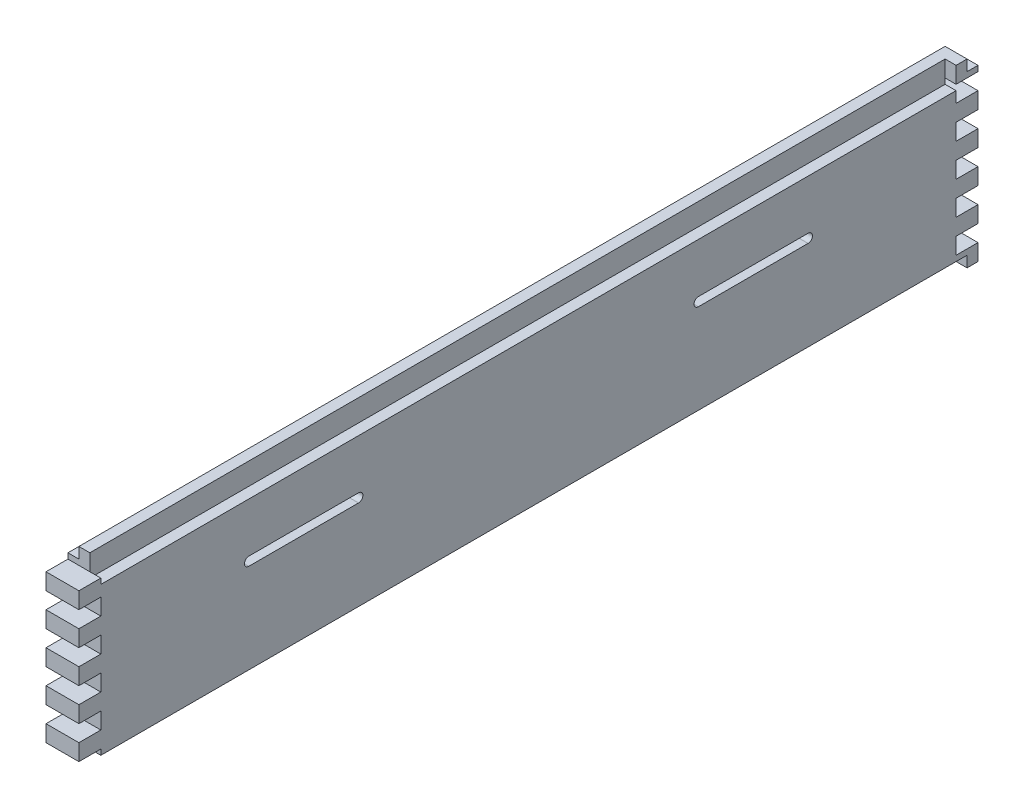
from build123d import *

# Parameters (mm, degrees)
EXTRUDE_1_DEPTH        = 820
SKETCH_2_W             = 10
SKETCH_2_H             = 10
EXTRUDE_2_DEPTH        = 20
SKETCH_4_W             = 20
SKETCH_4_H             = 20
EXTRUDE_3_DEPTH        = 10
SKETCH_5_W             = 10
SKETCH_5_H             = 10
CUT_EXTRUDE_2_DEPTH    = 837.973715238
CUT_EXTRUDE_3_DEPTH    = 837.973715238
SKETCH_7_W             = 20
SKETCH_7_H             = 15
CUT_EXTRUDE_4_DEPTH    = 837.973715238
PATTERN_LINEAR_1_COUNT = 6
PATTERN_LINEAR_1_PITCH = 30
SKETCH_8_W             = 20
SKETCH_8_H             = 15
CUT_EXTRUDE_5_DEPTH    = 837.973715238
PATTERN_LINEAR_2_COUNT = 5
PATTERN_LINEAR_2_PITCH = 30


with BuildPart() as part:
    # Эскиз1 → Бобышка-Вытянуть1 (new body)
    with BuildSketch(Plane.XY):
        Polygon((0, 0), (0, 155), (10, 155), (10, 165), (20, 165), (20, 145), (30, 145), (30, 10), (10, 10), (10, 0), align=None)
    extrude(amount=EXTRUDE_1_DEPTH)

    # Эскиз2 → Бобышка-Вытянуть2 (add)
    with BuildSketch(Plane(origin=(10, 0, 0), x_dir=(0, 0, -1), z_dir=(1, 0, 0))):
        with Locations((-815, 5)):
            Rectangle(SKETCH_2_W, SKETCH_2_H)
        with Locations((-5, 5)):
            Rectangle(SKETCH_2_W, SKETCH_2_H)
    extrude(amount=EXTRUDE_2_DEPTH)

    # Эскиз4 → Бобышка-Вытянуть3 (add)
    with BuildSketch(Plane(origin=(20, 0, 0), x_dir=(0, 0, -1), z_dir=(1, 0, 0))):
        with Locations((-810, 155)):
            Rectangle(SKETCH_4_W, SKETCH_4_H)
        with Locations((-10, 155)):
            Rectangle(SKETCH_4_W, SKETCH_4_H)
    extrude(amount=EXTRUDE_3_DEPTH)

    # Эскиз5 → Вырез-Вытянуть2 (cut, through all)
    with BuildSketch(Plane(origin=(30, 0, 0), x_dir=(0, 0, -1), z_dir=(1, 0, 0))):
        with Locations((-815, 160)):
            Rectangle(SKETCH_5_W, SKETCH_5_H)
        with Locations((-5, 160)):
            Rectangle(SKETCH_5_W, SKETCH_5_H)
    extrude(amount=-CUT_EXTRUDE_2_DEPTH, mode=Mode.SUBTRACT)

    # Эскиз6 → Вырез-Вытянуть3 (cut, through all)
    with BuildSketch(Plane(origin=(30, 0, 0), x_dir=(0, 0, -1), z_dir=(1, 0, 0))):
        with BuildLine():
            Line((-155, 91.846489001), (-255, 91.846489001))
            ThreePointArc((-255, 91.846489001), (-259, 95.846489001), (-255, 99.846489001))
            Line((-255, 99.846489001), (-155, 99.846489001))
            ThreePointArc((-155, 99.846489001), (-151, 95.846489001), (-155, 91.846489001))
        make_face()
        with BuildLine():
            Line((-665, 99.846489001), (-565, 99.846489001))
            ThreePointArc((-565, 99.846489001), (-561, 95.846489001), (-565, 91.846489001))
            Line((-565, 91.846489001), (-665, 91.846489001))
            ThreePointArc((-665, 91.846489001), (-669, 95.846489001), (-665, 99.846489001))
        make_face()
    extrude(amount=-CUT_EXTRUDE_3_DEPTH, mode=Mode.SUBTRACT)

    # Эскиз7 → Вырез-Вытянуть4 (cut, through all)
    with BuildSketch(Plane.ZY):
        with Locations((810, 7.5)):
            Rectangle(SKETCH_7_W, SKETCH_7_H)
    cut_extrude_4 = extrude(amount=-CUT_EXTRUDE_4_DEPTH, mode=Mode.SUBTRACT)

    # Линейный массив1: Вырез-Вытянуть4 ×6
    with Locations(*[(0, i * PATTERN_LINEAR_1_PITCH, 0) for i in range(1, PATTERN_LINEAR_1_COUNT)]):
        add(cut_extrude_4, mode=Mode.SUBTRACT)

    # Эскиз8 → Вырез-Вытянуть5 (cut, through all)
    with BuildSketch(Plane.ZY):
        with Locations((10, 22.5)):
            Rectangle(SKETCH_8_W, SKETCH_8_H)
    cut_extrude_5 = extrude(amount=-CUT_EXTRUDE_5_DEPTH, mode=Mode.SUBTRACT)

    # Линейный массив2: Вырез-Вытянуть5 ×5
    with Locations(*[(0, i * PATTERN_LINEAR_2_PITCH, 0) for i in range(1, PATTERN_LINEAR_2_COUNT)]):
        add(cut_extrude_5, mode=Mode.SUBTRACT)


solid = part.part
